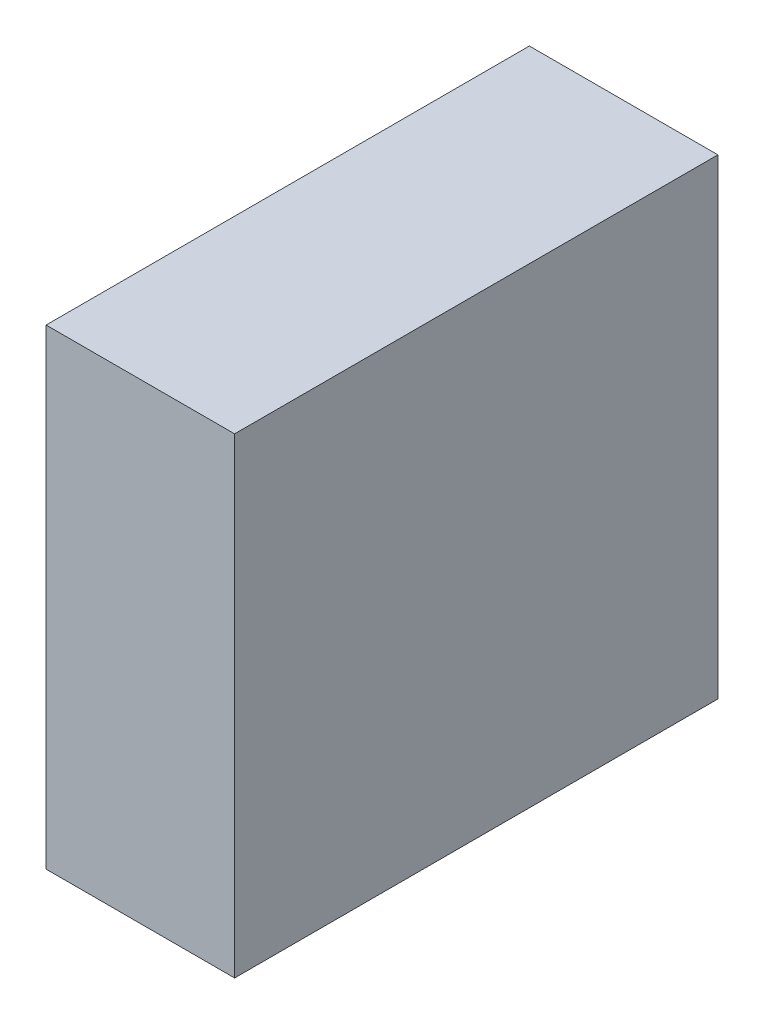
from build123d import *

# Parameters (mm, degrees)
SKETCH1_W           = 25.4
SKETCH1_H           = 63.5
BOSS_EXTRUDE1_DEPTH = 65.119999984


with BuildPart() as part:
    # Sketch1 → Boss-Extrude1 (new body)
    with BuildSketch(Plane.XY):
        Rectangle(SKETCH1_W, SKETCH1_H)
    extrude(amount=BOSS_EXTRUDE1_DEPTH)


solid = part.part
